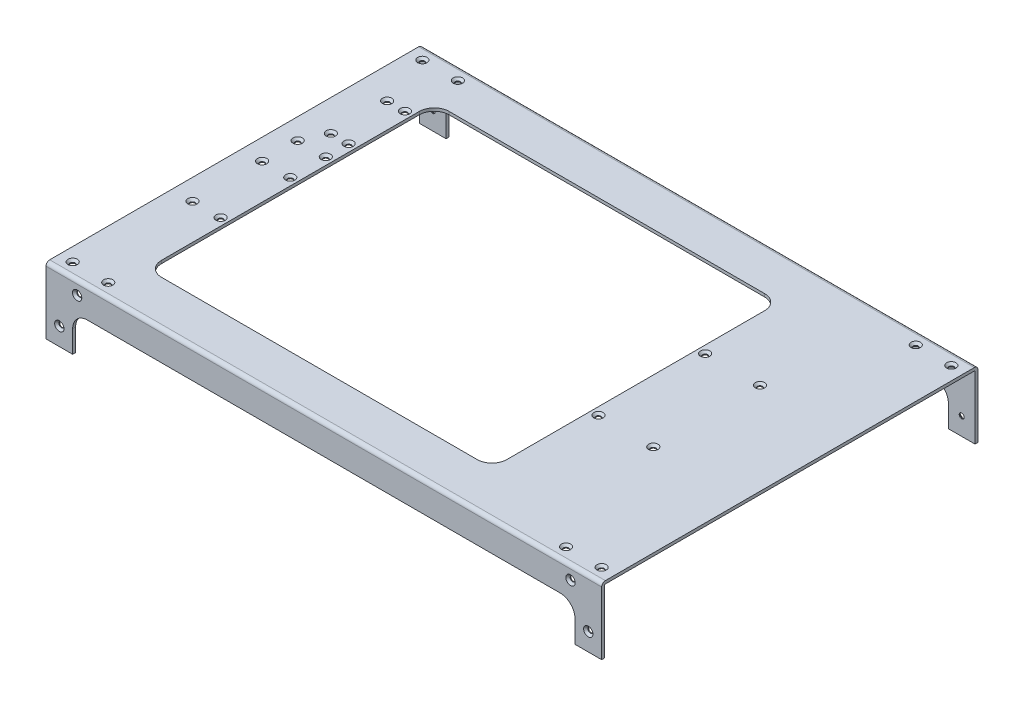
from build123d import *

# Parameters (mm, degrees)
BOSS_EXTRUDE1_DEPTH                             = 187.5
CUT_EXTRUDE1_DEPTH                              = 319.900062716
CUT_EXTRUDE2_DEPTH                              = 10
SKETCH4_R                                       = 1.5
CUT_EXTRUDE3_DEPTH                              = 319.900062716
SKETCH5_R                                       = 1.5
CUT_EXTRUDE4_DEPTH                              = 10
CSK_FOR_M3_FLAT_HEAD_MACHINE_SCREW1_D           = 3.4
CSK_FOR_M3_FLAT_HEAD_MACHINE_SCREW1_CSINK_D     = 6.3
CSK_FOR_M3_FLAT_HEAD_MACHINE_SCREW1_CSINK_ANGLE = 90
CSK_FOR_M3_FLAT_HEAD_MACHINE_SCREW2_D           = 3.4
CSK_FOR_M3_FLAT_HEAD_MACHINE_SCREW2_DEPTH       = 10
CSK_FOR_M3_FLAT_HEAD_MACHINE_SCREW2_CSINK_D     = 6.3
CSK_FOR_M3_FLAT_HEAD_MACHINE_SCREW2_CSINK_ANGLE = 90
CSK_FOR_M3_FLAT_HEAD_MACHINE_SCREW2_TIP         = 1.021463052
CSK_FOR_M3_FLAT_HEAD_MACHINE_SCREW3_D           = 3.4
CSK_FOR_M3_FLAT_HEAD_MACHINE_SCREW3_DEPTH       = 10
CSK_FOR_M3_FLAT_HEAD_MACHINE_SCREW3_CSINK_D     = 6.3
CSK_FOR_M3_FLAT_HEAD_MACHINE_SCREW3_CSINK_ANGLE = 90
CSK_FOR_M3_FLAT_HEAD_MACHINE_SCREW3_TIP         = 1.021463052


with BuildPart() as part:
    # Sketch1 → Boss-Extrude1 (new, symmetric)
    with BuildSketch(Plane(origin=(0, 0, 0), x_dir=(0, 0, -1), z_dir=(1, 0, 0))):
        with BuildLine():
            Line((125, -45), (127, -45))
            Line((127, -45), (127, -2.5))
            ThreePointArc((127, -2.5), (126.267766953, -0.732233047), (124.5, 0))
            Line((124.5, 0), (-124.5, 0))
            ThreePointArc((-124.5, 0), (-126.267766953, -0.732233047), (-127, -2.5))
            Line((-127, -2.5), (-127, -45))
            Line((-127, -45), (-125, -45))
            Line((-125, -45), (-125, -2.5))
            ThreePointArc((-125, -2.5), (-124.853553391, -2.146446609), (-124.5, -2))
            Line((-124.5, -2), (124.5, -2))
            ThreePointArc((124.5, -2), (124.853553391, -2.146446609), (125, -2.5))
            Line((125, -2.5), (125, -45))
        make_face()
    extrude(amount=BOSS_EXTRUDE1_DEPTH, both=True)

    # Sketch2 → Cut-Extrude1 (cut, through all)
    with BuildSketch(Plane.XY.offset(127)):
        with BuildLine():
            Line((-169.5, -45), (169.5, -45))
            Line((169.5, -45), (169.5, -30))
            ThreePointArc((169.5, -30), (166.571067812, -22.928932188), (159.5, -20))
            Line((159.5, -20), (-159.5, -20))
            ThreePointArc((-159.5, -20), (-166.571067812, -22.928932188), (-169.5, -30))
            Line((-169.5, -30), (-169.5, -45))
        make_face()
    extrude(amount=-CUT_EXTRUDE1_DEPTH, mode=Mode.SUBTRACT)

    # Sketch3 → Cut-Extrude2 (cut)
    with BuildSketch(Plane(origin=(0, 0, 0), x_dir=(1, 0, 0), z_dir=(0, 1, 0))):
        with BuildLine():
            Line((-139.5, 97), (73.5, 97))
            ThreePointArc((73.5, 97), (80.571067812, 94.071067812), (83.5, 87))
            Line((83.5, 87), (83.5, -87))
            ThreePointArc((83.5, -87), (80.571067812, -94.071067812), (73.5, -97))
            Line((73.5, -97), (-139.5, -97))
            ThreePointArc((-139.5, -97), (-146.571067812, -94.071067812), (-149.5, -87))
            Line((-149.5, -87), (-149.5, 87))
            ThreePointArc((-149.5, 87), (-146.571067812, 94.071067812), (-139.5, 97))
        make_face()
    extrude(amount=-CUT_EXTRUDE2_DEPTH, mode=Mode.SUBTRACT)

    # Sketch4 → Cut-Extrude3 (cut, through all)
    with BuildSketch(Plane.XY.offset(127)):
        with Locations((-178.5, -33)):
            Circle(SKETCH4_R)
        with Locations((-166.5, -9)):
            Circle(SKETCH4_R)
        with Locations((166.5, -9)):
            Circle(SKETCH4_R)
        with Locations((178.5, -33)):
            Circle(SKETCH4_R)
    extrude(amount=-CUT_EXTRUDE3_DEPTH, mode=Mode.SUBTRACT)

    # Sketch5 → Cut-Extrude4 (cut)
    with BuildSketch(Plane(origin=(0, 0, 0), x_dir=(1, 0, 0), z_dir=(0, 1, 0))):
        with Locations(Location((-178.5, 118, 0), (0, 0, 270))):
            Circle(SKETCH5_R)
        with Locations(Location((-154.5, 118, 0), (0, 0, 270))):
            Circle(SKETCH5_R)
        with Locations(Location((154.5, 118, 0), (0, 0, 270))):
            Circle(SKETCH5_R)
        with Locations(Location((178.5, 118, 0), (0, 0, 270))):
            Circle(SKETCH5_R)
        with Locations(Location((178.5, -118, 0), (0, 0, 270))):
            Circle(SKETCH5_R)
        with Locations(Location((154.5, -118, 0), (0, 0, 270))):
            Circle(SKETCH5_R)
        with Locations(Location((-178.5, -118, 0), (0, 0, 270))):
            Circle(SKETCH5_R)
        with Locations(Location((-154.5, -118, 0), (0, 0, 270))):
            Circle(SKETCH5_R)
        with Locations(Location((88.5, 41.85, 0), (0, 0, 270))):
            Circle(SKETCH5_R)
        with Locations(Location((88.5, -30.15, 0), (0, 0, 270))):
            Circle(SKETCH5_R)
        with Locations(Location((125.5, 41.85, 0), (0, 0, 270))):
            Circle(SKETCH5_R)
        with Locations(Location((125.5, -30.15, 0), (0, 0, 270))):
            Circle(SKETCH5_R)
        with Locations(Location((-154.5, 28.85, 0), (0, 0, 270))):
            Circle(SKETCH5_R)
        with Locations(Location((-173.5, 28.85, 0), (0, 0, 270))):
            Circle(SKETCH5_R)
        with Locations(Location((-173.5, 4.85, 0), (0, 0, 270))):
            Circle(SKETCH5_R)
        with Locations(Location((-154.5, 4.85, 0), (0, 0, 270))):
            Circle(SKETCH5_R)
        with Locations(Location((-154.5, -42.15, 0), (0, 0, 270))):
            Circle(SKETCH5_R)
        with Locations(Location((-173.5, -42.15, 0), (0, 0, 270))):
            Circle(SKETCH5_R)
        with Locations(Location((-166.5, 82.25, 0), (0, 0, 270))):
            Circle(SKETCH5_R)
        with Locations(Location((-154.5, 82.25, 0), (0, 0, 270))):
            Circle(SKETCH5_R)
        with Locations(Location((-166.5, 44.25, 0), (0, 0, 270))):
            Circle(SKETCH5_R)
        with Locations(Location((-154.5, 44.25, 0), (0, 0, 270))):
            Circle(SKETCH5_R)
    extrude(amount=-CUT_EXTRUDE4_DEPTH, mode=Mode.SUBTRACT)

    # CSK for M3 Flat Head Machine Screw1 (through all)
    with Locations(Plane(origin=(0, 0, 0), x_dir=(-1, 0, 0), z_dir=(0, 1, 0))):
        with Locations((154.5, 118), (178.5, 118), (154.5, 42.15), (173.5, 42.15), (154.5, -4.85), (173.5, -4.85), (173.5, -28.85), (154.5, -28.85), (154.5, -44.25), (166.5, -44.25), (166.5, -82.25), (154.5, -82.25), (178.5, -118), (154.5, -118), (-154.5, -118), (-178.5, -118), (-125.5, -41.85), (-88.5, -41.85), (-125.5, 30.15), (-88.5, 30.15), (-178.5, 118), (-154.5, 118)):
            CounterSinkHole(CSK_FOR_M3_FLAT_HEAD_MACHINE_SCREW1_D / 2, CSK_FOR_M3_FLAT_HEAD_MACHINE_SCREW1_CSINK_D / 2, counter_sink_angle=CSK_FOR_M3_FLAT_HEAD_MACHINE_SCREW1_CSINK_ANGLE)

    # CSK for M3 Flat Head Machine Screw2
    with Locations(Plane.XY.offset(127)):
        with Locations((166.5, -9), (178.5, -33), (-178.5, -33), (-166.5, -9)):
            CounterSinkHole(CSK_FOR_M3_FLAT_HEAD_MACHINE_SCREW2_D / 2, CSK_FOR_M3_FLAT_HEAD_MACHINE_SCREW2_CSINK_D / 2, depth=CSK_FOR_M3_FLAT_HEAD_MACHINE_SCREW2_DEPTH, counter_sink_angle=CSK_FOR_M3_FLAT_HEAD_MACHINE_SCREW2_CSINK_ANGLE)
            with Locations((0, 0, -(CSK_FOR_M3_FLAT_HEAD_MACHINE_SCREW2_DEPTH + CSK_FOR_M3_FLAT_HEAD_MACHINE_SCREW2_TIP / 2))):  # 118° drill point
                Cone(0, CSK_FOR_M3_FLAT_HEAD_MACHINE_SCREW2_D / 2, CSK_FOR_M3_FLAT_HEAD_MACHINE_SCREW2_TIP, mode=Mode.SUBTRACT)

    # CSK for M3 Flat Head Machine Screw3
    with Locations(Plane(origin=(0, 0, -127), x_dir=(-1, 0, 0), z_dir=(0, 0, -1))):
        with Locations((-166.5, -9), (178.5, -33), (166.5, -9), (-178.5, -33)):
            CounterSinkHole(CSK_FOR_M3_FLAT_HEAD_MACHINE_SCREW3_D / 2, CSK_FOR_M3_FLAT_HEAD_MACHINE_SCREW3_CSINK_D / 2, depth=CSK_FOR_M3_FLAT_HEAD_MACHINE_SCREW3_DEPTH, counter_sink_angle=CSK_FOR_M3_FLAT_HEAD_MACHINE_SCREW3_CSINK_ANGLE)
            with Locations((0, 0, -(CSK_FOR_M3_FLAT_HEAD_MACHINE_SCREW3_DEPTH + CSK_FOR_M3_FLAT_HEAD_MACHINE_SCREW3_TIP / 2))):  # 118° drill point
                Cone(0, CSK_FOR_M3_FLAT_HEAD_MACHINE_SCREW3_D / 2, CSK_FOR_M3_FLAT_HEAD_MACHINE_SCREW3_TIP, mode=Mode.SUBTRACT)


solid = part.part
